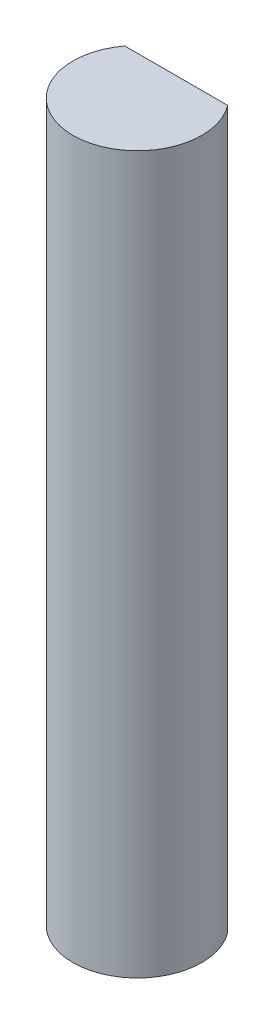
from build123d import *

# Parameters (mm, degrees)
ESQUISSE1_R        = 3.15
BOSS_EXTRU_1_DEPTH = 17.5
SKETCH1_W          = 5.02493781
SKETCH1_H          = 1.5
CUT_EXTRUDE1_DEPTH = 35


with BuildPart() as part:
    # Esquisse1 → Boss.-Extru.1 (new, symmetric)
    with BuildSketch(Plane(origin=(0, 0, 0), x_dir=(1, 0, 0), z_dir=(0, 1, 0))):
        with Locations(Location((0, 0, 0), (0, 0, 270))):
            Circle(ESQUISSE1_R)
    extrude(amount=BOSS_EXTRU_1_DEPTH, both=True)

    # Sketch1 → Cut-Extrude1 (cut)
    with BuildSketch(Plane(origin=(0, 17.5, 0), x_dir=(1, 0, 0), z_dir=(0, 1, 0))):
        with Locations((0, 2.65)):
            Rectangle(SKETCH1_W, SKETCH1_H)
    extrude(amount=-CUT_EXTRUDE1_DEPTH, mode=Mode.SUBTRACT)


solid = part.part
